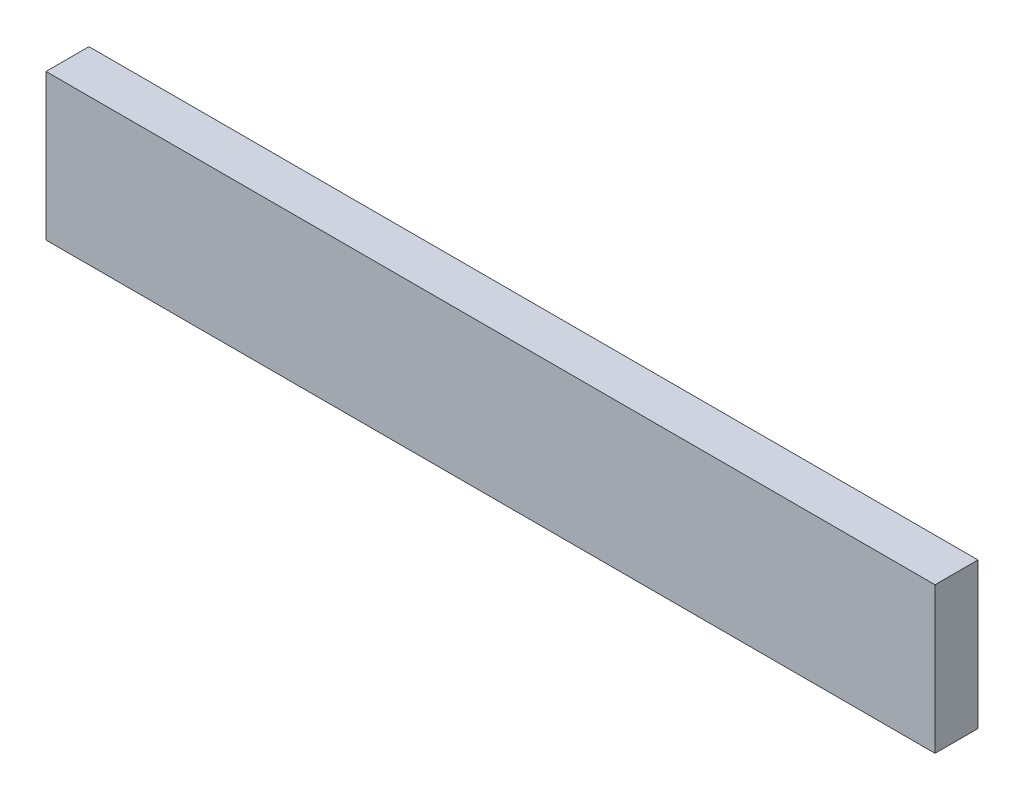
from build123d import *

# Parameters (mm, degrees)
SKIZZE1_W                       = 207
SKIZZE1_H                       = 34
AUFSATZ_LINEAR_AUSTRAGEN1_DEPTH = 10


with BuildPart() as part:
    # Skizze1 → Aufsatz-Linear austragen1 (new body)
    with BuildSketch(Plane.XY):
        Rectangle(SKIZZE1_W, SKIZZE1_H)
    extrude(amount=AUFSATZ_LINEAR_AUSTRAGEN1_DEPTH)


solid = part.part
